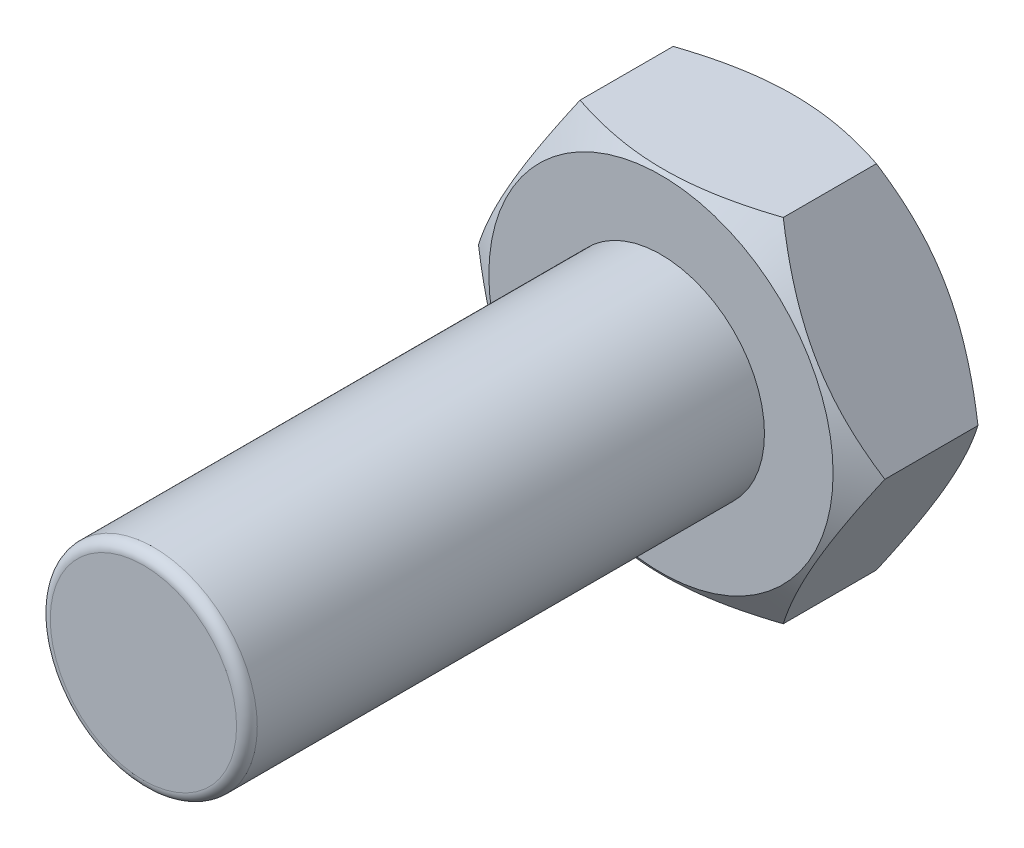
from build123d import *

# Parameters (mm, degrees)
Y_KSEKLIK_EKSTR_ZYON1_DEPTH = 6.5
IZIM2_R                     = 5
Y_KSEKLIK_EKSTR_ZYON2_DEPTH = 25
RADYUS1_R                   = 0.5


with BuildPart() as part:
    # Çizim1 → Yükseklik-Ekstrüzyon1 (new body)
    with BuildSketch(Plane.XY):
        Polygon((9.814954576, 0), (4.907477288, 8.5), (-4.907477288, 8.5), (-9.814954576, 0), (-4.907477288, -8.5), (4.907477288, -8.5), align=None)
    extrude(amount=Y_KSEKLIK_EKSTR_ZYON1_DEPTH)

    # Çizim2 → Yükseklik-Ekstrüzyon2 (add)
    with BuildSketch(Plane.XY.offset(6.5)):
        Circle(IZIM2_R)
    extrude(amount=Y_KSEKLIK_EKSTR_ZYON2_DEPTH)

    # Çizim3 → Kes-Döndür1 (revolve, cut)
    with BuildSketch(Plane(origin=(0, 0, 0), x_dir=(1, 0, 0), z_dir=(0, 1, 0))):
        Polygon((-9.814954576, 0), (-8.314954576, 0), (-9.814954576, -1), align=None)
        Polygon((-9.814954576, -6.5), (-9.814954576, -5.5), (-8.314954576, -6.5), align=None)
    revolve(axis=Axis((0, 0, 0), (0, 0, 1)), mode=Mode.SUBTRACT)

    # Radyus1
    radyus1_edges = [part.edges().sort_by_distance(p)[0] for p in [
        (-5, 0, 31.5),
    ]]
    fillet(radyus1_edges, radius=RADYUS1_R)


solid = part.part
